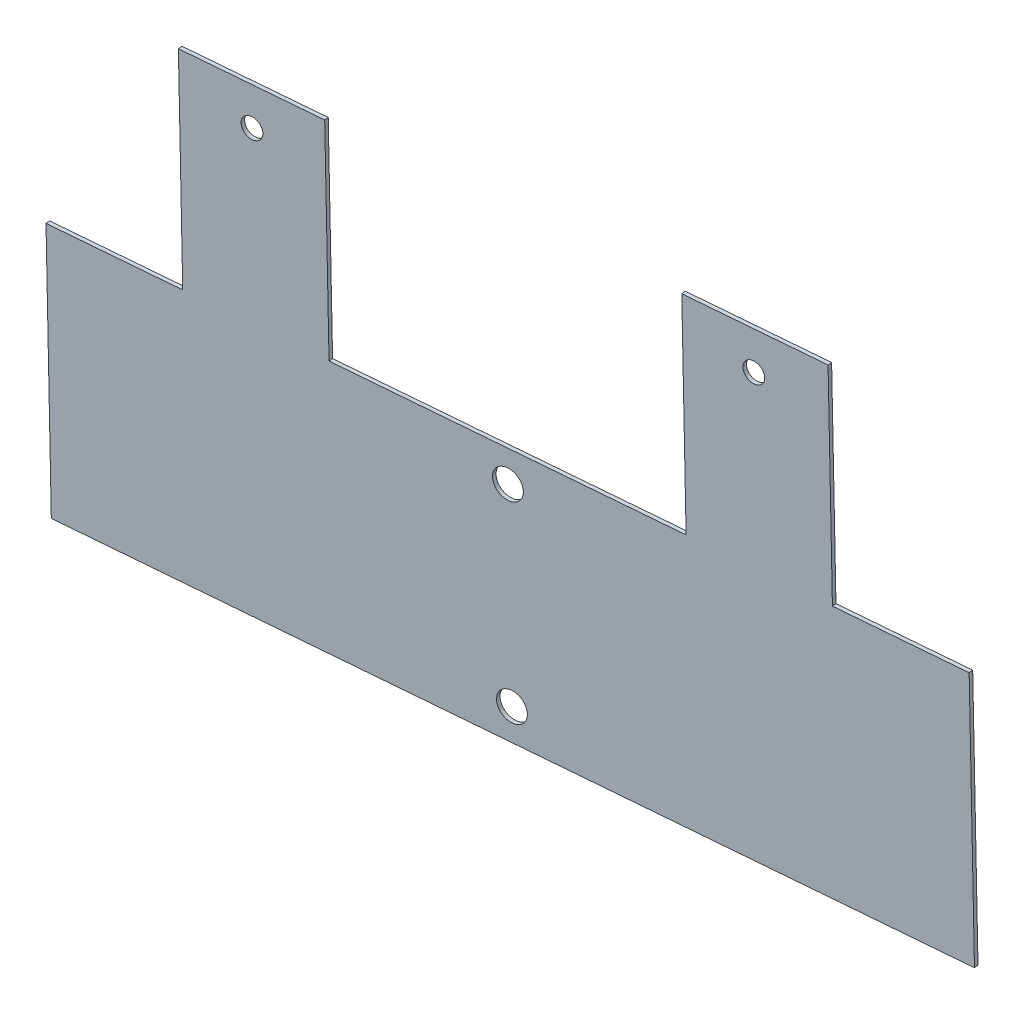
from build123d import *

# Parameters (mm, degrees)
BOSS_EXTRUDE1_DEPTH = 0.6096
SKETCH5_R           = 2.25
CUT_EXTRUDE2_DEPTH  = 0.6096
SKETCH6_R           = 1.5875
CUT_EXTRUDE5_DEPTH  = 0.6096
SKETCH7_R           = 1.5875
CUT_EXTRUDE6_DEPTH  = 0.6096


with BuildPart() as part:
    # Sketch1 → Boss-Extrude1 (new body)
    with BuildSketch(Plane(origin=(16.997226787, -4.149929847, 204.631375634), x_dir=(0.9965694099183702, 0.001959509651517015, -0.0827379691367708), z_dir=(-0.08276069418699705, 0.02020630066742909, -0.9963645783100802))):
        Polygon((-405.631572024, 283.216979703), (-385.692572024, 283.216979703), (-385.692572024, 323.856979703), (-405.014358213, 323.856979703), (-432.414358217, 323.856979703), (-445.097076418, 323.856979703), (-465.359895626, 323.856979703), (-479.498480719, 323.856979703), (-500.373572024, 323.856979703), (-520.312572024, 323.856979703), (-520.312572024, 283.216979703), (-500.373572024, 283.216979703), (-500.373572024, 250.003685703), (-479.037572024, 250.003685703), (-479.037572024, 283.216979703), (-426.967572024, 283.216979703), (-426.967572024, 250.003685703), (-405.631572024, 250.003685703), align=None)
    extrude(amount=BOSS_EXTRUDE1_DEPTH)

    # Sketch5 → Cut-Extrude2 (cut)
    with BuildSketch(Plane(origin=(16.946775868, -4.137612086, 204.023991787), x_dir=(-0.9965694494101686, -0.0016780440853138524, 0.08274368054637986), z_dir=(-0.08276069418699686, 0.020206300667429084, -0.9963645783100801))):
        with Locations(Location((452.956635294, -318.984510283, 0), (0, 0, 0.096164523))):
            Circle(SKETCH5_R)
    cut_extrude2 = extrude(amount=-CUT_EXTRUDE2_DEPTH, mode=Mode.SUBTRACT)

    # Mirror1: Cut-Extrude2 across plane
    add(cut_extrude2.mirror(Plane(origin=(0.085159645, -303.474424262, -6.16154314), x_dir=(5.696257509048789e-06, -0.02029915071256956, 0.9997939509958544), z_dir=(0.00028055772663953236, -0.9997939116314238, -0.020299151511798782))), mode=Mode.SUBTRACT)

    # Sketch6 → Cut-Extrude5 (cut)
    with BuildSketch(Plane(origin=(16.946775868, -4.137612086, 204.023991787), x_dir=(-0.9965694494101686, -0.0016780440853136297, 0.08274368054637984), z_dir=(-0.08276069418699684, 0.02020630066742912, -0.9963645783100802))):
        with Locations(Location((416.50680125, -256.173836565, 0), (0, 0, 0.096164523))):
            Circle(SKETCH6_R)
    extrude(amount=-CUT_EXTRUDE5_DEPTH, mode=Mode.SUBTRACT)

    # Sketch7 → Cut-Extrude6 (cut)
    with BuildSketch(Plane(origin=(16.946775868, -4.137612086, 204.023991787), x_dir=(-0.9965694494101686, -0.0016780440853141857, 0.08274368054637986), z_dir=(-0.08276069418699686, 0.020206300667429056, -0.9963645783100801))):
        with Locations(Location((489.681466673, -256.194436956, 0), (0, 0, 0.096164523))):
            Circle(SKETCH7_R)
    extrude(amount=-CUT_EXTRUDE6_DEPTH, mode=Mode.SUBTRACT)


solid = part.part
